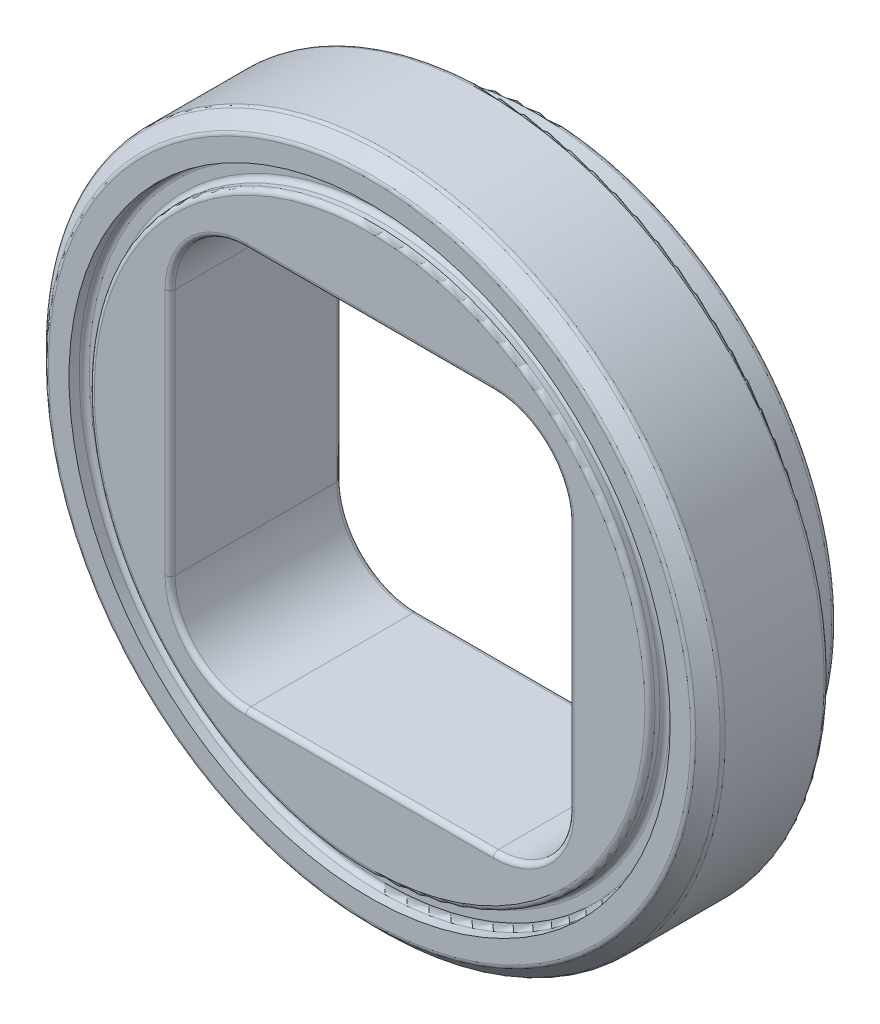
from build123d import *

# Parameters (mm, degrees)
SKETCH1_R           = 67
BOSS_EXTRUDE1_DEPTH = 24
SKETCH1_4_R         = 59.505720785
SKETCH1_4_R_2       = 55.505720785
CUT_EXTRUDE1_DEPTH  = 3
SKETCH2_R           = 58.465659197
BOSS_EXTRUDE2_DEPTH = 10
CHAMFER1_SIZE       = 5
CHAMFER2_SIZE       = 3
FILLET1_R           = 1


with BuildPart() as part:
    # Sketch1 → Boss-Extrude1 (new body)
    with BuildSketch(Plane.XY):
        Circle(SKETCH1_R)
        with BuildLine():
            Line((-24.5, 39.5), (24.5, 39.5))
            ThreePointArc((24.5, 39.5), (35.106601718, 35.106601718), (39.5, 24.5))
            Line((39.5, 24.5), (39.5, -24.5))
            ThreePointArc((39.5, -24.5), (35.106601718, -35.106601718), (24.5, -39.5))
            Line((24.5, -39.5), (-24.5, -39.5))
            ThreePointArc((-24.5, -39.5), (-35.106601718, -35.106601718), (-39.5, -24.5))
            Line((-39.5, -24.5), (-39.5, 24.5))
            ThreePointArc((-39.5, 24.5), (-35.106601718, 35.106601718), (-24.5, 39.5))
        make_face(mode=Mode.SUBTRACT)
    extrude(amount=-BOSS_EXTRUDE1_DEPTH)

    # Sketch1<4> → Cut-Extrude1 (cut)
    with BuildSketch(Plane.XY):
        Circle(SKETCH1_4_R)
        Circle(SKETCH1_4_R_2, mode=Mode.SUBTRACT)
    extrude(amount=-CUT_EXTRUDE1_DEPTH, mode=Mode.SUBTRACT)

    # Sketch2 → Boss-Extrude2 (add)
    with BuildSketch(Plane(origin=(0, 0, -24), x_dir=(-1, 0, 0), z_dir=(0, 0, -1))):
        Circle(SKETCH2_R)
        with BuildLine():
            ThreePointArc((39.5, -24.5), (35.106601718, -35.106601718), (24.5, -39.5))
            Line((24.5, -39.5), (-24.5, -39.5))
            ThreePointArc((-24.5, -39.5), (-35.106601718, -35.106601718), (-39.5, -24.5))
            Line((-39.5, -24.5), (-39.5, 24.5))
            ThreePointArc((-39.5, 24.5), (-35.106601718, 35.106601718), (-24.5, 39.5))
            Line((-24.5, 39.5), (24.5, 39.5))
            ThreePointArc((24.5, 39.5), (35.106601718, 35.106601718), (39.5, 24.5))
            Line((39.5, 24.5), (39.5, -24.5))
        make_face(mode=Mode.SUBTRACT)
    extrude(amount=BOSS_EXTRUDE2_DEPTH)

    # Chamfer1
    chamfer1_edges = [part.edges().sort_by_distance(p)[0] for p in [
        (58.465659197, 0, -24),
    ]]
    chamfer(chamfer1_edges, length=CHAMFER1_SIZE)

    # Chamfer2
    chamfer2_edges = [part.edges().sort_by_distance(p)[0] for p in [
        (-67, 0, 0),
    ]]
    chamfer(chamfer2_edges, length=CHAMFER2_SIZE)

    # Fillet1
    fillet1_edges = [part.edges().sort_by_distance(p)[0] for p in [
        (35.106601718, 35.106601718, -34),
        (39.5, 0, -34),
        (35.106601718, -35.106601718, -34),
        (0, -39.5, -34),
        (-35.106601718, -35.106601718, -34),
        (-39.5, 0, -34),
        (-35.106601718, 35.106601718, -34),
        (0, 39.5, 0),
        (-35.106601718, 35.106601718, 0),
        (-39.5, 0, 0),
        (-35.106601718, -35.106601718, 0),
        (0, -39.5, 0),
        (35.106601718, -35.106601718, 0),
        (39.5, 0, 0),
        (-64, 0, 0),
        (-59.505720785, 0, -3),
        (-55.505720785, 0, -3),
        (0, 39.5, -34),
        (58.465659197, 0, -34),
        (58.465659197, 0, -29),
        (63.465659197, 0, -24),
        (-67, 0, -24),
        (35.106601718, 35.106601718, 0),
        (-55.505720785, 0, 0),
        (-67, 0, -3),
    ]]
    fillet(fillet1_edges, radius=FILLET1_R)


solid = part.part
